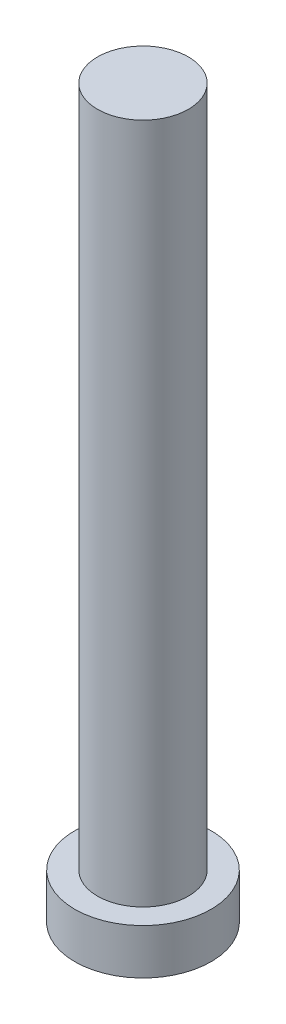
from build123d import *

# Parameters (mm, degrees)
SKETCH1_R           = 15
BOSS_EXTRUDE1_DEPTH = 10
SKETCH2_R           = 10
BOSS_EXTRUDE2_DEPTH = 150


with BuildPart() as part:
    # Sketch1 → Boss-Extrude1 (new body)
    with BuildSketch(Plane(origin=(0, 0, 0), x_dir=(1, 0, 0), z_dir=(0, 1, 0))):
        Circle(SKETCH1_R)
    extrude(amount=BOSS_EXTRUDE1_DEPTH)

    # Sketch2 → Boss-Extrude2 (add)
    with BuildSketch(Plane(origin=(0, 10, 0), x_dir=(1, 0, 0), z_dir=(0, 1, 0))):
        Circle(SKETCH2_R)
    extrude(amount=BOSS_EXTRUDE2_DEPTH)


solid = part.part
